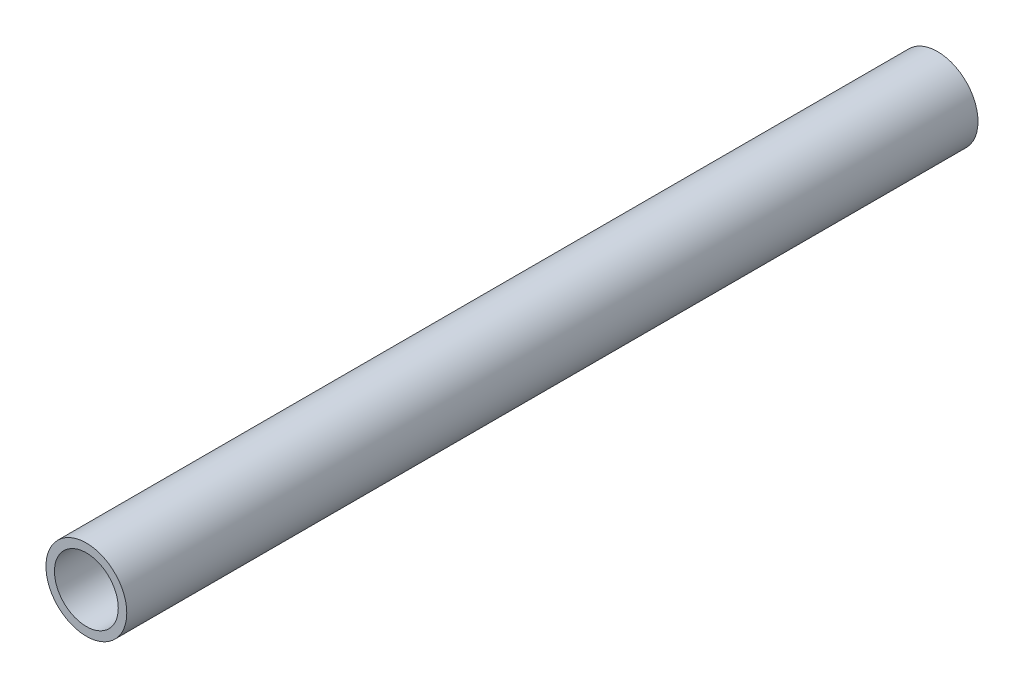
from build123d import *

# Parameters (mm, degrees)
SKETCH1_R           = 9.5
SKETCH1_R_2         = 7.5
BOSS_EXTRUDE1_DEPTH = 200


with BuildPart() as part:
    # Sketch1 → Boss-Extrude1 (new body)
    with BuildSketch(Plane.XY):
        Circle(SKETCH1_R)
        Circle(SKETCH1_R_2, mode=Mode.SUBTRACT)
    extrude(amount=BOSS_EXTRUDE1_DEPTH)


solid = part.part
